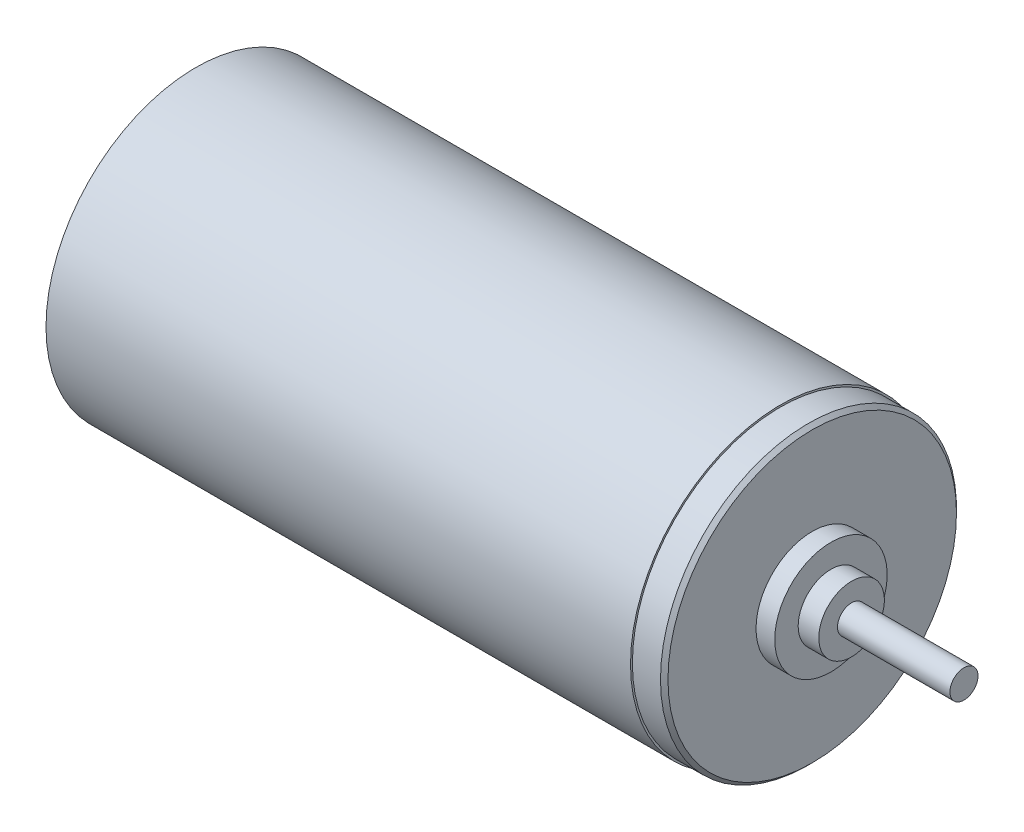
from build123d import *

# Parameters (mm, degrees)
CHANFREIN1_SIZE = 0.2


with BuildPart() as part:
    # Esquisse1 → Révolution1 (revolve)
    with BuildSketch(Plane.XY, mode=Mode.PRIVATE) as r_volution1_sk:
        Polygon((-53.031441654, 0), (-53.031441654, 8), (-21.831441654, 8), (-21.831441654, 7.9), (-20.131441654, 7.9), (-20.131441654, 3), (-19.131441654, 3), (-19.131441654, 1.75), (-18.031441654, 1.75), (-18.031441654, 0.75), (-12.031441654, 0.75), (-12.031441654, 0), align=None)
    revolve(r_volution1_sk.sketch.rotate(Axis((-60.261349275, 0, 0), (1, 0, 0)), 90), axis=Axis((-60.261349275, 0, 0), (1, 0, 0)))

    # Chanfrein1
    chanfrein1_edges = [part.edges().sort_by_distance(p)[0] for p in [
        (-20.131441654, 0, -7.9),
    ]]
    chamfer(chanfrein1_edges, length=CHANFREIN1_SIZE)


solid = part.part
